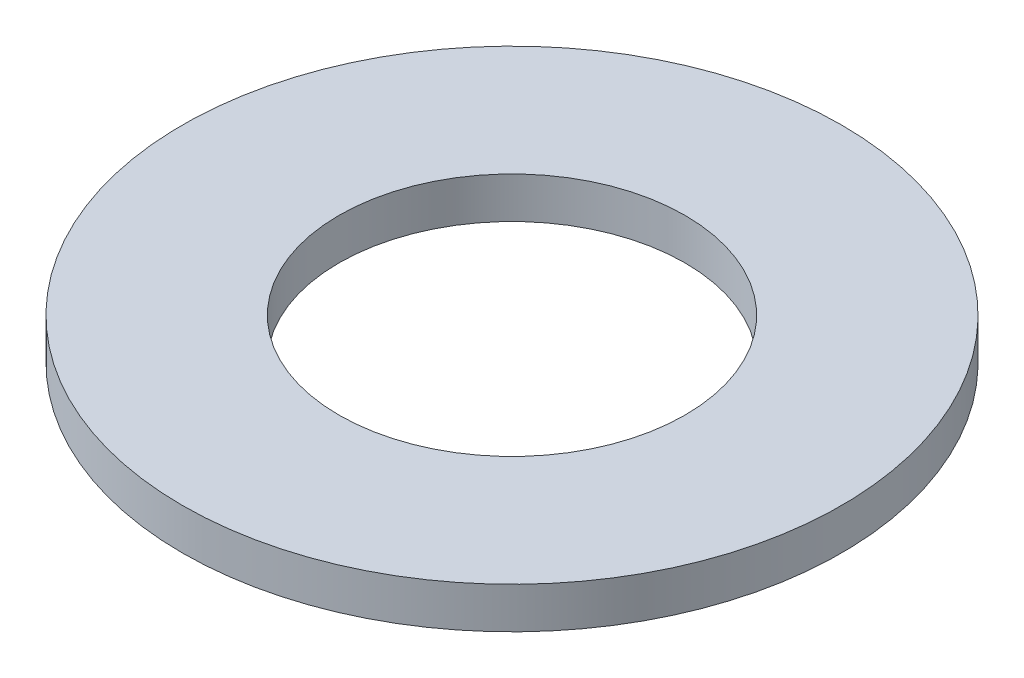
from build123d import *

# Parameters (mm, degrees)
SKETCH1_R           = 8
SKETCH1_R_2         = 4.2
BOSS_EXTRUDE1_DEPTH = 1


with BuildPart() as part:
    # Sketch1 → Boss-Extrude1 (new body)
    with BuildSketch(Plane(origin=(0, 0, 0), x_dir=(1, 0, 0), z_dir=(0, 1, 0))):
        with Locations(Location((0, 0, 0), (0, 0, 270))):
            Circle(SKETCH1_R)
        with Locations(Location((0, 0, 0), (0, 0, 270))):
            Circle(SKETCH1_R_2, mode=Mode.SUBTRACT)
    extrude(amount=BOSS_EXTRUDE1_DEPTH)


solid = part.part
